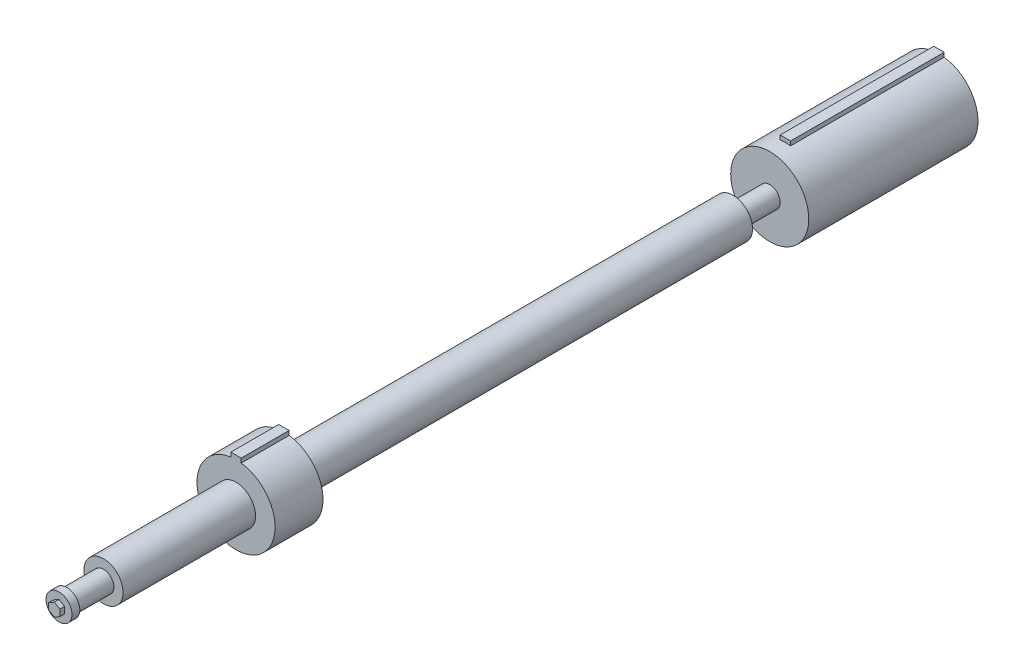
from build123d import *

# Parameters (mm, degrees)
CROQUIS1_R               = 4
SALIENTE_EXTRUIR1_DEPTH  = 135
CROQUIS2_R               = 5
SALIENTE_EXTRUIR2_DEPTH  = 3
SALIENTE_EXTRUIR3_DEPTH  = 1.8
CROQUIS4_R               = 7.5
SALIENTE_EXTRUIR4_DEPTH  = 120.9
CROQUIS5_R               = 15
SALIENTE_EXTRUIR5_DEPTH  = 15
CROQUIS7_W               = 4
CROQUIS7_H               = 3
SALIENTE_EXTRUIR6_DEPTH  = 15
SALIENTE_EXTRUIR7_DEPTH  = 3.4
CROQUIS9_R               = 15
SALIENTE_EXTRUIR8_DEPTH  = 6
CROQUIS10_R              = 15
SALIENTE_EXTRUIR9_DEPTH  = 10
SALIENTE_EXTRUIR10_DEPTH = 49


with BuildPart() as part:
    # Croquis1 → Saliente-Extruir1 (new, symmetric)
    with BuildSketch(Plane.XY):
        Circle(CROQUIS1_R)
    extrude(amount=SALIENTE_EXTRUIR1_DEPTH, both=True)

    # Croquis2 → Saliente-Extruir2 (add)
    with BuildSketch(Plane.XY.offset(135)):
        Circle(CROQUIS2_R)
    extrude(amount=SALIENTE_EXTRUIR2_DEPTH)

    # Croquis3 → Saliente-Extruir3 (add)
    with BuildSketch(Plane.XY.offset(138)):
        Polygon((0, 2.5), (-2.165063509, 1.25), (-2.165063509, -1.25), (0, -2.5), (2.165063509, -1.25), (2.165063509, 1.25), align=None)
    extrude(amount=SALIENTE_EXTRUIR3_DEPTH)

    # Croquis4 → Saliente-Extruir4 (add, symmetric)
    with BuildSketch(Plane.XY):
        Circle(CROQUIS4_R)
    extrude(amount=SALIENTE_EXTRUIR4_DEPTH, both=True)

    # Croquis5 → Saliente-Extruir5 (add)
    with BuildSketch(Plane(origin=(0, 0, 70), x_dir=(-1, 0, 0), z_dir=(0, 0, -1))):
        Circle(CROQUIS5_R)
    extrude(amount=SALIENTE_EXTRUIR5_DEPTH)

    # Croquis7 → Saliente-Extruir6 (add)
    with BuildSketch(Plane.XY.offset(70)):
        with Locations((0, 15)):
            Rectangle(CROQUIS7_W, CROQUIS7_H)
    extrude(amount=-SALIENTE_EXTRUIR6_DEPTH)

    # Croquis8 → Saliente-Extruir7 (add)
    with BuildSketch(Plane(origin=(0, 0, 55), x_dir=(-1, 0, 0), z_dir=(0, 0, -1))):
        with BuildLine():
            Line((2, 14.866068747), (2, 16.5))
            Line((2, 16.5), (-2, 16.5))
            Line((-2, 16.5), (-2, 14.866068747))
            ThreePointArc((-2, 14.866068747), (0, -15), (2, 14.866068747))
        make_face()
    extrude(amount=SALIENTE_EXTRUIR7_DEPTH)

    # Croquis9 → Saliente-Extruir8 (add)
    with BuildSketch(Plane(origin=(0, 0, -135), x_dir=(-1, 0, 0), z_dir=(0, 0, -1))):
        Circle(CROQUIS9_R)
    extrude(amount=SALIENTE_EXTRUIR8_DEPTH)

    # Croquis10 → Saliente-Extruir9 (add)
    with BuildSketch(Plane(origin=(0, 0, -141), x_dir=(-1, 0, 0), z_dir=(0, 0, -1))):
        with Locations(Location((0, 0, 0), (0, 0, 97.662255661))):
            Circle(CROQUIS10_R)
        with BuildLine():
            Line((-2, 16.5), (-2, 14.866068747))
            ThreePointArc((-2, 14.866068747), (0, 15), (2, 14.866068747))
            Line((2, 14.866068747), (2, 16.5))
            Line((2, 16.5), (-2, 16.5))
        make_face()
    extrude(amount=SALIENTE_EXTRUIR9_DEPTH)

    # Croquis11 → Saliente-Extruir10 (add)
    with BuildSketch(Plane(origin=(0, 0, -151), x_dir=(-1, 0, 0), z_dir=(0, 0, -1))):
        with BuildLine():
            Line((2, 14.866068747), (2, 16.5))
            Line((2, 16.5), (-2, 16.5))
            Line((-2, 16.5), (-2, 14.866068747))
            ThreePointArc((-2, 14.866068747), (0, -15), (2, 14.866068747))
        make_face()
    extrude(amount=SALIENTE_EXTRUIR10_DEPTH)


solid = part.part
